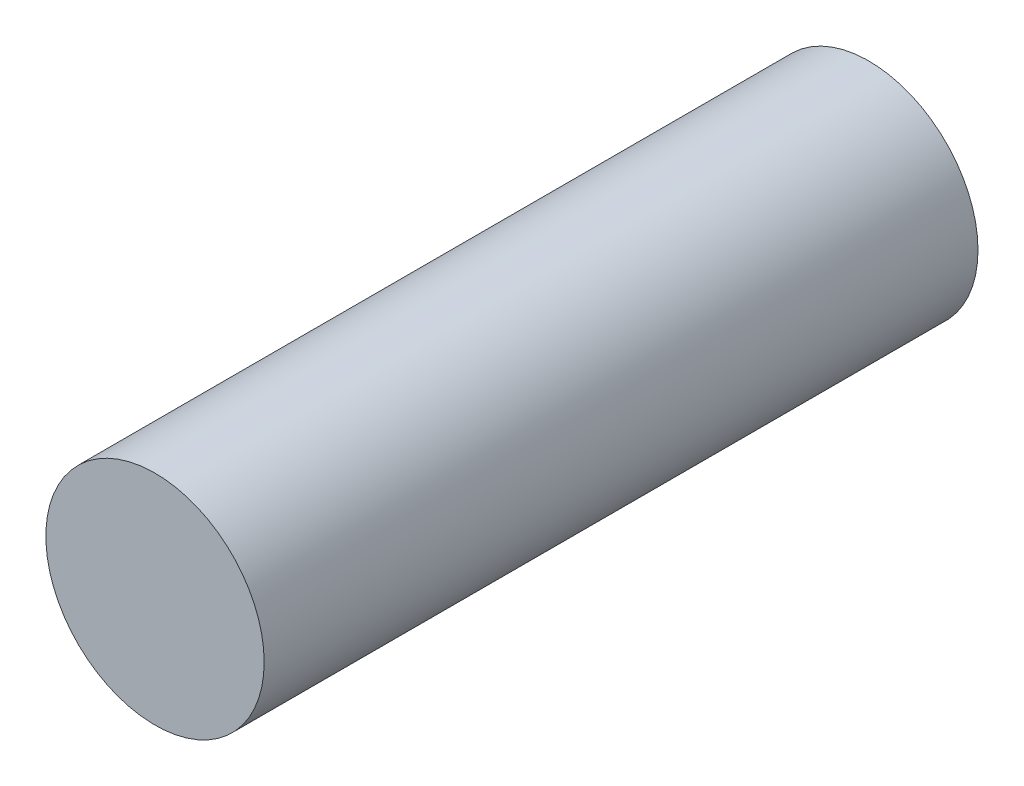
from build123d import *

# Parameters (mm, degrees)
SKETCH2_R           = 3.175
BOSS_EXTRUDE1_DEPTH = 20.76196


with BuildPart() as part:
    # Sketch2 → Boss-Extrude1 (new body)
    with BuildSketch(Plane.XY):
        Circle(SKETCH2_R)
    extrude(amount=BOSS_EXTRUDE1_DEPTH)


solid = part.part
